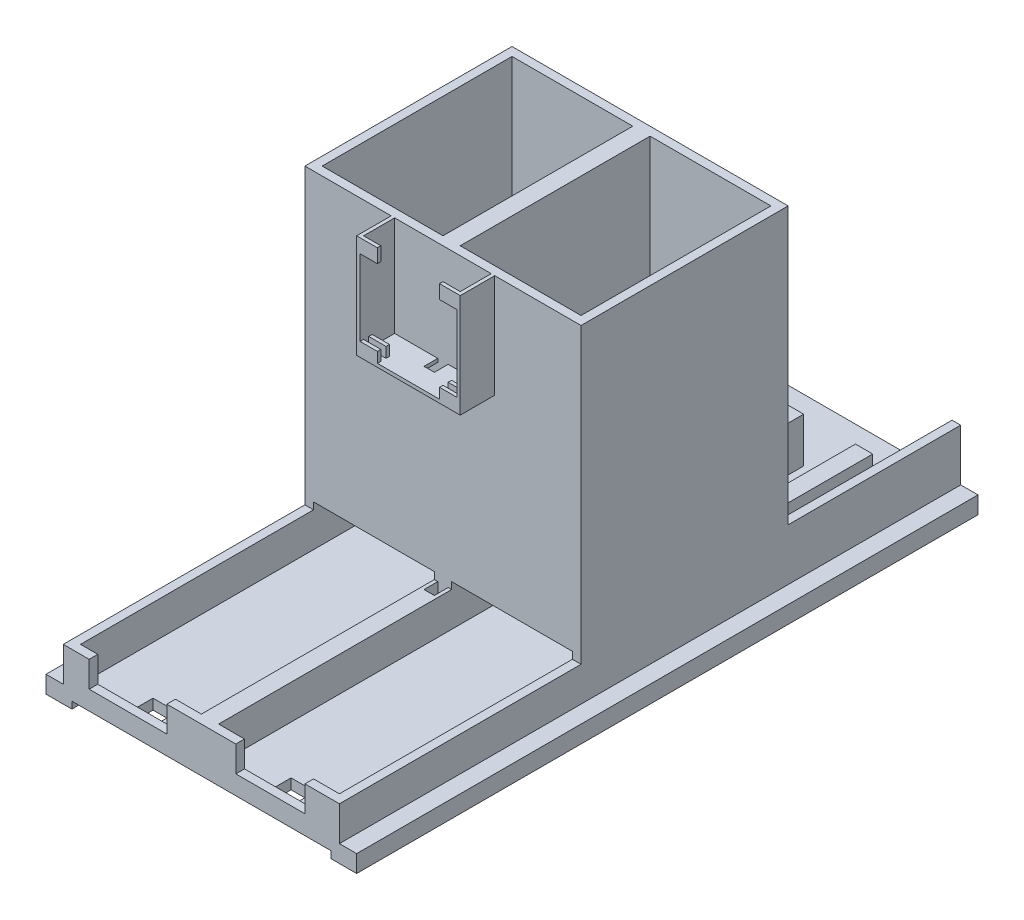
from build123d import *

# Parameters (mm, degrees)
SKETCH1_W                                   = 80
SKETCH1_H                                   = 60
BOSS_EXTRUDE1_DEPTH                         = 100
CUT_EXTRUDE1_START                          = 5
SKETCH2_W                                   = 35
SKETCH2_H                                   = 55
CUT_EXTRUDE1_DEPTH                          = 95
SKETCH3_W                                   = 80
SKETCH3_H                                   = 5
BOSS_EXTRUDE2_DEPTH                         = 70
BOSS_EXTRUDE3_DEPTH                         = 10
SKETCH5_W                                   = 22.5
SKETCH5_H                                   = 2.5
SKETCH5_W_2                                 = 20
CUT_EXTRUDE2_DEPTH                          = 7.5
SKETCH6_W                                   = 35
SKETCH6_H                                   = 12
CUT_EXTRUDE4_DEPTH                          = 57.5
CUT_EXTRUDE6_REACH                          = 184.483
SKETCH7_R                                   = 4
SKETCH9_W                                   = 80
SKETCH9_H                                   = 50
BOSS_EXTRUDE4_DEPTH                         = 5
SKETCH11_W                                  = 75
SKETCH11_H                                  = 32.5
CUT_EXTRUDE7_DEPTH                          = 2
SKETCH13_W                                  = 7
SKETCH13_H                                  = 7
CUT_EXTRUDE8_DEPTH                          = 166.90660023
BOSS_EXTRUDE5_DEPTH                         = 10
SKETCH15_W                                  = 6
SKETCH15_H                                  = 4
BOSS_EXTRUDE6_DEPTH                         = 1
BOSS_EXTRUDE7_START                         = -2.5
SKETCH15_2_W                                = 6
SKETCH15_2_H                                = 4
BOSS_EXTRUDE7_DEPTH                         = 1
SKETCH17_W                                  = 6
SKETCH17_H                                  = 4
BOSS_EXTRUDE8_DEPTH                         = 1
SKETCH18_W                                  = 3
SKETCH18_H                                  = 4
CUT_EXTRUDE9_OLED_CABLE_DEPTH               = 154.430766146
SKETCH20_W                                  = 5
SKETCH20_H                                  = 5
CUT_EXTRUDE10_SOLENOID_WIRE_DEPTH           = 166.90660023
SKETCH21_W                                  = 5
SKETCH21_H                                  = 32
BOSS_EXTRUDE9_SOLENOID_SIDE_SUPPORT_DEPTH   = 13
SKETCH27_W                                  = 2.5
SKETCH27_H                                  = 50
BOSS_EXTRUDE13_SOLENOID_SECTION_WALLS_DEPTH = 15
SKETCH29_W                                  = 180
SKETCH29_H                                  = 5
BOSS_EXTRUDE9_GUIDE_DEPTH                   = 5
BOSS_EXTRUDE10_START                        = -80
SKETCH29_3_W                                = 180
SKETCH29_3_H                                = 5
BOSS_EXTRUDE10_GUIDE_DEPTH                  = 5


with BuildPart() as part:
    # Sketch1 → Boss-Extrude1 (new body)
    with BuildSketch(Plane(origin=(0, 0, 0), x_dir=(1, 0, 0), z_dir=(0, 1, 0))):
        with Locations((40, 30)):
            Rectangle(SKETCH1_W, SKETCH1_H)
    extrude(amount=BOSS_EXTRUDE1_DEPTH)

    # Sketch2 → Cut-Extrude1 (cut)
    with BuildSketch(Plane(origin=(0, 0, 0), x_dir=(1, 0, 0), z_dir=(0, 1, 0)).offset(CUT_EXTRUDE1_START)):
        with Locations((20, 30)):
            Rectangle(SKETCH2_W, SKETCH2_H)
        with Locations((60, 30)):
            Rectangle(SKETCH2_W, SKETCH2_H)
    extrude(amount=CUT_EXTRUDE1_DEPTH, mode=Mode.SUBTRACT)

    # Sketch3 → Boss-Extrude2 (add)
    with BuildSketch(Plane.XY):
        with Locations((40, 2.5)):
            Rectangle(SKETCH3_W, SKETCH3_H)
    extrude(amount=BOSS_EXTRUDE2_DEPTH)

    # Sketch4 → Boss-Extrude3 (add)
    with BuildSketch(Plane(origin=(0, 5, 0), x_dir=(1, 0, 0), z_dir=(0, 1, 0))):
        Polygon((80, 0), (77.5, 0), (77.5, -67.5), (42.5, -67.5), (42.5, 0), (37.5, 0), (37.5, -67.5), (2.5, -67.5), (2.5, 0), (0, 0), (0, -70), (80, -70), align=None)
    extrude(amount=BOSS_EXTRUDE3_DEPTH)

    # Sketch5 → Cut-Extrude2 (cut)
    with BuildSketch(Plane(origin=(0, 15, 0), x_dir=(1, 0, 0), z_dir=(0, 1, 0))):
        with Locations((18.75, -68.75)):
            Rectangle(SKETCH5_W, SKETCH5_H)
        with Locations((60, -68.75)):
            Rectangle(SKETCH5_W_2, SKETCH5_H)
    extrude(amount=-CUT_EXTRUDE2_DEPTH, mode=Mode.SUBTRACT)

    # Sketch6 → Cut-Extrude4 (cut)
    with BuildSketch(Plane.XY):
        with Locations((20, 11)):
            Rectangle(SKETCH6_W, SKETCH6_H)
        with Locations((60, 11)):
            Rectangle(SKETCH6_W, SKETCH6_H)
    extrude(amount=-CUT_EXTRUDE4_DEPTH, mode=Mode.SUBTRACT)

    # Sketch7 → Cut-Extrude6 (cut, up to next)
    with BuildSketch(Plane(origin=(0, 0, -60), x_dir=(-1, 0, 0), z_dir=(0, 0, -1)), mode=Mode.PRIVATE) as cut_extrude6_sk1:
        with Locations((-20, 11.5)):
            Circle(SKETCH7_R)
    cut_extrude6_tool1 = extrude(cut_extrude6_sk1.sketch, amount=-CUT_EXTRUDE6_REACH, mode=Mode.PRIVATE) & part.part
    # Sketch7 → Cut-Extrude6 (cut, up to next)
    with BuildSketch(Plane(origin=(0, 0, -60), x_dir=(-1, 0, 0), z_dir=(0, 0, -1)), mode=Mode.PRIVATE) as cut_extrude6_sk2:
        with Locations((-60, 11.5)):
            Circle(SKETCH7_R)
    cut_extrude6_tool2 = extrude(cut_extrude6_sk2.sketch, amount=-CUT_EXTRUDE6_REACH, mode=Mode.PRIVATE) & part.part
    add(cut_extrude6_tool1.solids().sort_by_distance((20, 11.5, -60))[0], mode=Mode.SUBTRACT)
    add(cut_extrude6_tool2.solids().sort_by_distance((60, 11.5, -60))[0], mode=Mode.SUBTRACT)

    # Sketch9 → Boss-Extrude4 (add)
    with BuildSketch(Plane(origin=(0, 0, 0), x_dir=(1, 0, 0), z_dir=(0, 1, 0))):
        with Locations((40, 85)):
            Rectangle(SKETCH9_W, SKETCH9_H)
    extrude(amount=BOSS_EXTRUDE4_DEPTH)

    # Sketch11 → Cut-Extrude7 (cut)
    with BuildSketch(Plane.XZ):
        with Locations((40, 53.75)):
            Rectangle(SKETCH11_W, SKETCH11_H)
    extrude(amount=-CUT_EXTRUDE7_DEPTH, mode=Mode.SUBTRACT)

    # Sketch13 → Cut-Extrude8 (cut, through all)
    with BuildSketch(Plane(origin=(0, 5, 0), x_dir=(1, 0, 0), z_dir=(0, 1, 0))):
        with Locations((20, -64)):
            Rectangle(SKETCH13_W, SKETCH13_H)
        with Locations((60, -64)):
            Rectangle(SKETCH13_W, SKETCH13_H)
    extrude(amount=-CUT_EXTRUDE8_DEPTH, mode=Mode.SUBTRACT)

    # Sketch14 → Boss-Extrude5 (add)
    with BuildSketch(Plane.XY):
        Polygon((25, 100), (26, 100), (26, 71), (54, 71), (54, 100), (55, 100), (55, 70), (54, 70), (26, 70), (25, 70), align=None)
    extrude(amount=BOSS_EXTRUDE5_DEPTH)

    # Sketch15 → Boss-Extrude6 (add)
    with BuildSketch(Plane.XY.offset(10)):
        with Locations((28, 72)):
            Rectangle(SKETCH15_W, SKETCH15_H)
        with Locations((52, 72)):
            Rectangle(SKETCH15_W, SKETCH15_H)
    extrude(amount=-BOSS_EXTRUDE6_DEPTH)

    # Sketch15<2> → Boss-Extrude7 (add)
    with BuildSketch(Plane.XY.offset(10).offset(BOSS_EXTRUDE7_START)):
        with Locations((28, 72)):
            Rectangle(SKETCH15_2_W, SKETCH15_2_H)
        with Locations((52, 72)):
            Rectangle(SKETCH15_2_W, SKETCH15_2_H)
    extrude(amount=-BOSS_EXTRUDE7_DEPTH)

    # Sketch17 → Boss-Extrude8 (add)
    with BuildSketch(Plane.XY.offset(10)):
        with Locations((28, 98)):
            Rectangle(SKETCH17_W, SKETCH17_H)
        with Locations((52, 98)):
            Rectangle(SKETCH17_W, SKETCH17_H)
    extrude(amount=-BOSS_EXTRUDE8_DEPTH)

    # Sketch18 → Cut-Extrude9 (OLED Cable) (cut, through all)
    with BuildSketch(Plane(origin=(0, 71, 0), x_dir=(1, 0, 0), z_dir=(0, 1, 0))):
        with Locations((40, -2)):
            Rectangle(SKETCH18_W, SKETCH18_H)
    extrude(amount=-CUT_EXTRUDE9_OLED_CABLE_DEPTH, mode=Mode.SUBTRACT)

    # Sketch20 → Cut-Extrude10 (Solenoid Wire) (cut, through all)
    with BuildSketch(Plane(origin=(0, 5, 0), x_dir=(1, 0, 0), z_dir=(0, 1, 0))):
        with Locations((60, 62.5)):
            Rectangle(SKETCH20_W, SKETCH20_H)
        with Locations((20, 62.5)):
            Rectangle(SKETCH20_W, SKETCH20_H)
    extrude(amount=-CUT_EXTRUDE10_SOLENOID_WIRE_DEPTH, mode=Mode.SUBTRACT)

    # Sketch21 → Boss-Extrude9 (Solenoid Side Support) (add)
    with BuildSketch(Plane(origin=(0, 5, 0), x_dir=(1, 0, 0), z_dir=(0, 1, 0))):
        with Locations((70, 76)):
            Rectangle(SKETCH21_W, SKETCH21_H)
        with Locations((50, 76)):
            Rectangle(SKETCH21_W, SKETCH21_H)
        with Locations((30, 76)):
            Rectangle(SKETCH21_W, SKETCH21_H)
        with Locations((10, 76)):
            Rectangle(SKETCH21_W, SKETCH21_H)
    extrude(amount=BOSS_EXTRUDE9_SOLENOID_SIDE_SUPPORT_DEPTH)

    # Sketch27 → Boss-Extrude13 (Solenoid Section Walls) (add)
    with BuildSketch(Plane(origin=(0, 5, 0), x_dir=(1, 0, 0), z_dir=(0, 1, 0))):
        with Locations((78.75, 85)):
            Rectangle(SKETCH27_W, SKETCH27_H)
        with Locations((1.25, 85)):
            Rectangle(SKETCH27_W, SKETCH27_H)
    extrude(amount=BOSS_EXTRUDE13_SOLENOID_SECTION_WALLS_DEPTH)

    # Sketch29 → Boss-Extrude9 (Guide) (add)
    with BuildSketch(Plane(origin=(80, 0, 0), x_dir=(0, 0, -1), z_dir=(1, 0, 0))):
        with Locations((20, 2.5)):
            Rectangle(SKETCH29_W, SKETCH29_H)
    extrude(amount=BOSS_EXTRUDE9_GUIDE_DEPTH)

    # Sketch29<3> → Boss-Extrude10 (Guide) (add)
    with BuildSketch(Plane(origin=(80, 0, 0), x_dir=(0, 0, -1), z_dir=(1, 0, 0)).offset(BOSS_EXTRUDE10_START)):
        with Locations((20, 2.5)):
            Rectangle(SKETCH29_3_W, SKETCH29_3_H)
    extrude(amount=-BOSS_EXTRUDE10_GUIDE_DEPTH)


solid = part.part
